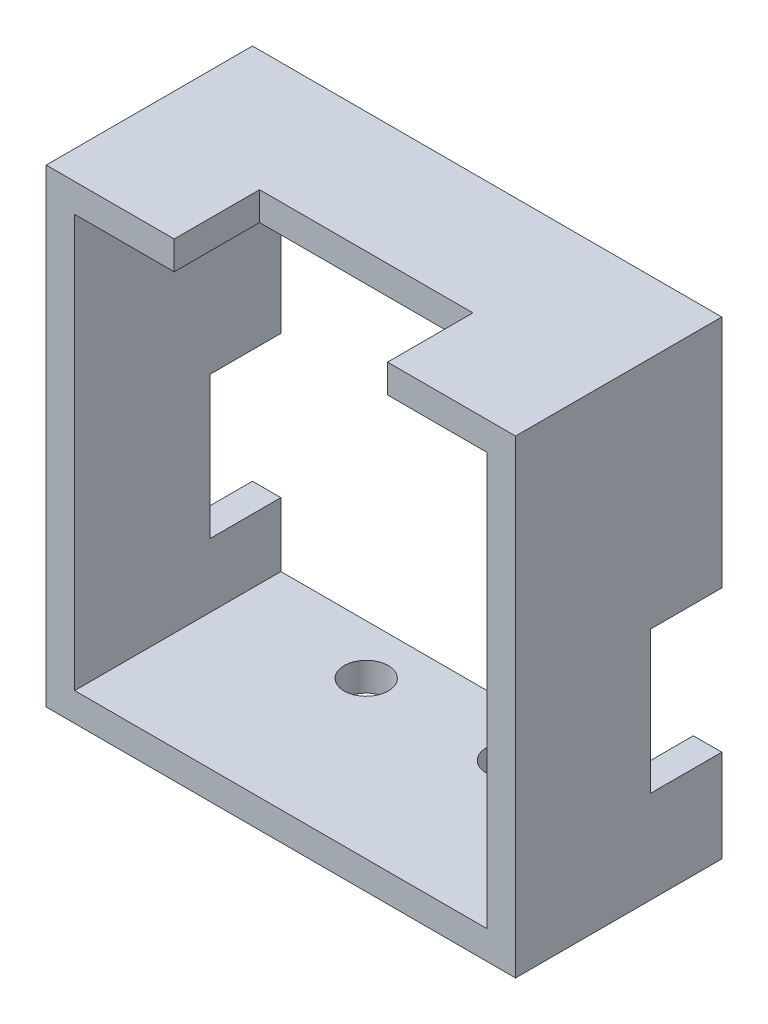
from build123d import *

# Parameters (mm, degrees)
SKETCH_1_W               = 33
SKETCH_1_H               = 33
SKETCH_1_W_2             = 29
SKETCH_1_H_2             = 29
EXTRUDE_1_DEPTH          = 14.5
CUT_EXTRUDE_2_REACH      = 49.542
SKETCH_3_W               = 15
SKETCH_3_H               = 6
CUT_EXTRUDE_4_REACH      = 49.542
SKETCH_5_R               = 1.55
CUT_EXTRUDE_5_DEPTH      = 48.542086618
CUT_EXTRUDE_5_DEPTH_BACK = 48.542086618
SKETCH_6_W               = 5
SKETCH_6_H               = 10


with BuildPart() as part:
    # 草图1 → 凸台-拉伸1 (new body)
    with BuildSketch(Plane.XY):
        with Locations((14.5, 14.5)):
            Rectangle(SKETCH_1_W, SKETCH_1_H)
        with Locations((14.5, 14.5)):
            Rectangle(SKETCH_1_W_2, SKETCH_1_H_2, mode=Mode.SUBTRACT)
    extrude(amount=EXTRUDE_1_DEPTH)

    # 草图3 → 切除-拉伸2 (cut, up to next)
    with BuildSketch(Plane(origin=(0, 31, 0), x_dir=(1, 0, 0), z_dir=(0, 1, 0)), mode=Mode.PRIVATE) as cut_extrude_2_sk1:
        with Locations((14.5, -11.5)):
            Rectangle(SKETCH_3_W, SKETCH_3_H)
    cut_extrude_2_tool1 = extrude(cut_extrude_2_sk1.sketch, amount=-CUT_EXTRUDE_2_REACH, mode=Mode.PRIVATE) & part.part
    add(cut_extrude_2_tool1.solids().sort_by_distance((14.5, 31, 11.5))[0], mode=Mode.SUBTRACT)

    # 草图5 → 切除-拉伸4 (cut, up to next)
    with BuildSketch(Plane.XZ.offset(2), mode=Mode.PRIVATE) as cut_extrude_4_sk1:
        with Locations(Location((19.5, 3.5, 0), (0, 0, 270))):
            Circle(SKETCH_5_R)
    cut_extrude_4_tool1 = extrude(cut_extrude_4_sk1.sketch, amount=-CUT_EXTRUDE_4_REACH, mode=Mode.PRIVATE) & part.part
    # 草图5 → 切除-拉伸4 (cut, up to next)
    with BuildSketch(Plane.XZ.offset(2), mode=Mode.PRIVATE) as cut_extrude_4_sk2:
        with Locations(Location((9.5, 3.5, 0), (0, 0, 90))):
            Circle(SKETCH_5_R)
    cut_extrude_4_tool2 = extrude(cut_extrude_4_sk2.sketch, amount=-CUT_EXTRUDE_4_REACH, mode=Mode.PRIVATE) & part.part
    add(cut_extrude_4_tool1.solids().sort_by_distance((19.5, -2, 3.5))[0], mode=Mode.SUBTRACT)
    add(cut_extrude_4_tool2.solids().sort_by_distance((9.5, -2, 3.5))[0], mode=Mode.SUBTRACT)

    # 草图6 → 切除-拉伸5 (cut, two sides: drawn at the far end of the back side and taken through both)
    with BuildSketch(Plane.ZY.offset(2).offset(-CUT_EXTRUDE_5_DEPTH_BACK)):
        with Locations((2.5, 9.5)):
            Rectangle(SKETCH_6_W, SKETCH_6_H)
    extrude(amount=CUT_EXTRUDE_5_DEPTH + CUT_EXTRUDE_5_DEPTH_BACK, mode=Mode.SUBTRACT)


solid = part.part
